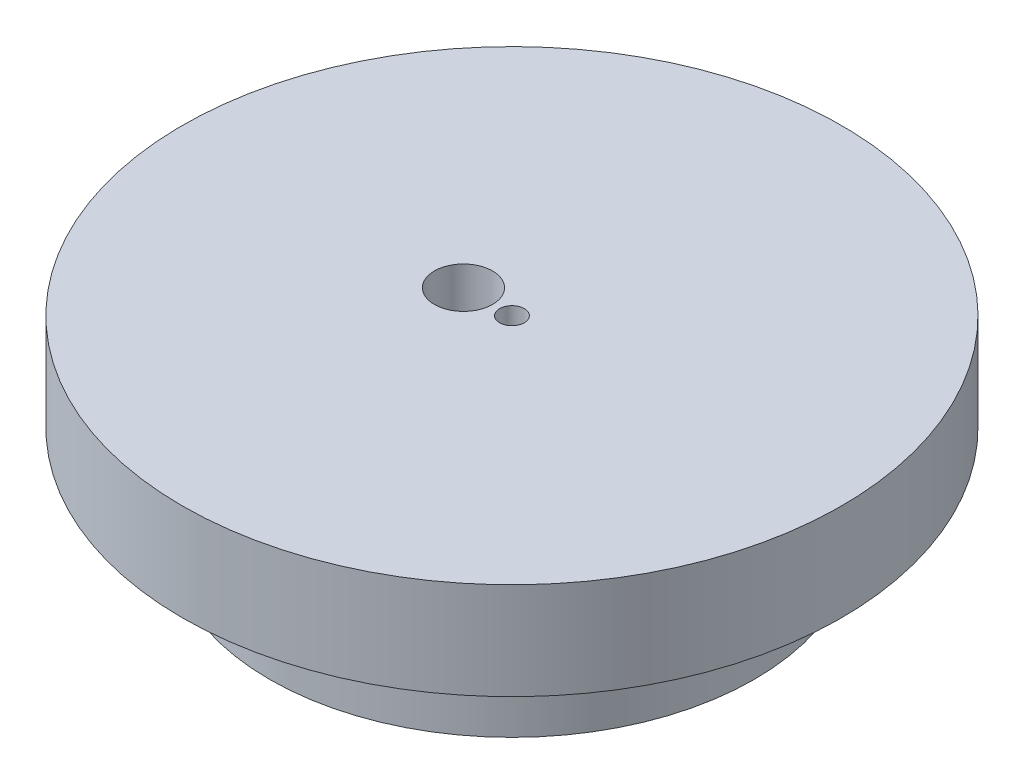
from build123d import *

# Parameters (mm, degrees)
SKETCH1_R           = 25
BOSS_EXTRUDE1_DEPTH = 10
SKETCH2_R           = 34
SKETCH2_R_2         = 1.27
BOSS_EXTRUDE2_DEPTH = 10
SKETCH3_R           = 3
CUT_EXTRUDE1_DEPTH  = 53.076866265


with BuildPart() as part:
    # Sketch1 → Boss-Extrude1 (new body)
    with BuildSketch(Plane(origin=(0, 0, 0), x_dir=(1, 0, 0), z_dir=(0, 1, 0))):
        with Locations(Location((0, 0, 0), (0, 0, 270))):
            Circle(SKETCH1_R)
        with BuildLine():
            Line((-1.506818182, 11.05), (1.506818182, 11.05))
            Line((1.506818182, 11.05), (2.436951779, 8.183494179))
            ThreePointArc((2.436951779, 8.183494179), (3.267594671, 7.888671372), (4.063419099, 7.509789356))
            Line((4.063419099, 7.509789356), (6.748048578, 8.879011286))
            Line((6.748048578, 8.879011286), (8.879011286, 6.748048578))
            Line((8.879011286, 6.748048578), (7.509789356, 4.063419099))
            ThreePointArc((7.509789356, 4.063419099), (7.888671372, 3.267594671), (8.183494179, 2.436951779))
            Line((8.183494179, 2.436951779), (11.05, 1.506818182))
            Line((11.05, 1.506818182), (11.05, -1.506818182))
            Line((11.05, -1.506818182), (8.183494179, -2.436951779))
            ThreePointArc((8.183494179, -2.436951779), (7.888671372, -3.267594671), (7.509789356, -4.063419099))
            Line((7.509789356, -4.063419099), (8.879011286, -6.748048578))
            Line((8.879011286, -6.748048578), (6.748048578, -8.879011286))
            Line((6.748048578, -8.879011286), (4.063419099, -7.509789356))
            ThreePointArc((4.063419099, -7.509789356), (3.267594671, -7.888671372), (2.436951779, -8.183494179))
            Line((2.436951779, -8.183494179), (1.506818182, -11.05))
            Line((1.506818182, -11.05), (-1.506818182, -11.05))
            Line((-1.506818182, -11.05), (-2.436951779, -8.183494179))
            ThreePointArc((-2.436951779, -8.183494179), (-3.267594671, -7.888671372), (-4.063419099, -7.509789356))
            Line((-4.063419099, -7.509789356), (-6.748048578, -8.879011286))
            Line((-6.748048578, -8.879011286), (-8.879011286, -6.748048578))
            Line((-8.879011286, -6.748048578), (-7.509789356, -4.063419099))
            ThreePointArc((-7.509789356, -4.063419099), (-7.888671372, -3.267594671), (-8.183494179, -2.436951779))
            Line((-8.183494179, -2.436951779), (-11.05, -1.506818182))
            Line((-11.05, -1.506818182), (-11.05, 1.506818182))
            Line((-11.05, 1.506818182), (-8.183494179, 2.436951779))
            ThreePointArc((-8.183494179, 2.436951779), (-7.888671372, 3.267594671), (-7.509789356, 4.063419099))
            Line((-7.509789356, 4.063419099), (-8.879011286, 6.748048578))
            Line((-8.879011286, 6.748048578), (-6.748048578, 8.879011286))
            Line((-6.748048578, 8.879011286), (-4.063419099, 7.509789356))
            ThreePointArc((-4.063419099, 7.509789356), (-3.267594671, 7.888671372), (-2.436951779, 8.183494179))
            Line((-2.436951779, 8.183494179), (-1.506818182, 11.05))
        make_face(mode=Mode.SUBTRACT)
    extrude(amount=BOSS_EXTRUDE1_DEPTH)

    # Sketch2 → Boss-Extrude2 (add)
    with BuildSketch(Plane(origin=(0, 10, 0), x_dir=(1, 0, 0), z_dir=(0, 1, 0))):
        with Locations(Location((0, 0, 0), (0, 0, 270))):
            Circle(SKETCH2_R)
        with Locations(Location((0, 0, 0), (0, 0, 270))):
            Circle(SKETCH2_R_2, mode=Mode.SUBTRACT)
    extrude(amount=BOSS_EXTRUDE2_DEPTH)

    # Sketch3 → Cut-Extrude1 (cut, through all)
    with BuildSketch(Plane(origin=(0, 20, 0), x_dir=(1, 0, 0), z_dir=(0, 1, 0))):
        with Locations(Location((-5, 0, 0), (0, 0, 270))):
            Circle(SKETCH3_R)
    extrude(amount=-CUT_EXTRUDE1_DEPTH, mode=Mode.SUBTRACT)


solid = part.part
